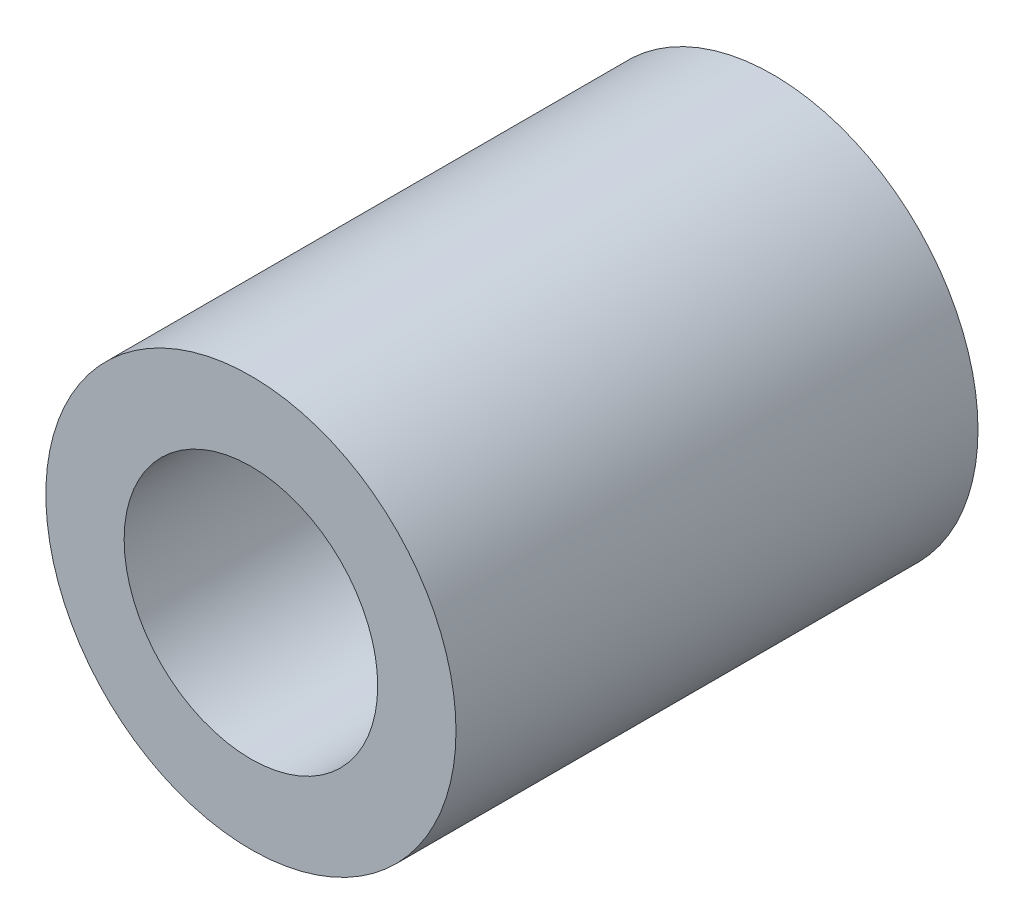
from build123d import *

# Parameters (mm, degrees)
SKETCH_1_R      = 2.75
SKETCH_1_R_2    = 1.7
EXTRUDE_1_DEPTH = 7


with BuildPart() as part:
    # 草图1 → 凸台-拉伸1 (new body)
    with BuildSketch(Plane.XY):
        Circle(SKETCH_1_R)
        Circle(SKETCH_1_R_2, mode=Mode.SUBTRACT)
    extrude(amount=EXTRUDE_1_DEPTH)


solid = part.part
